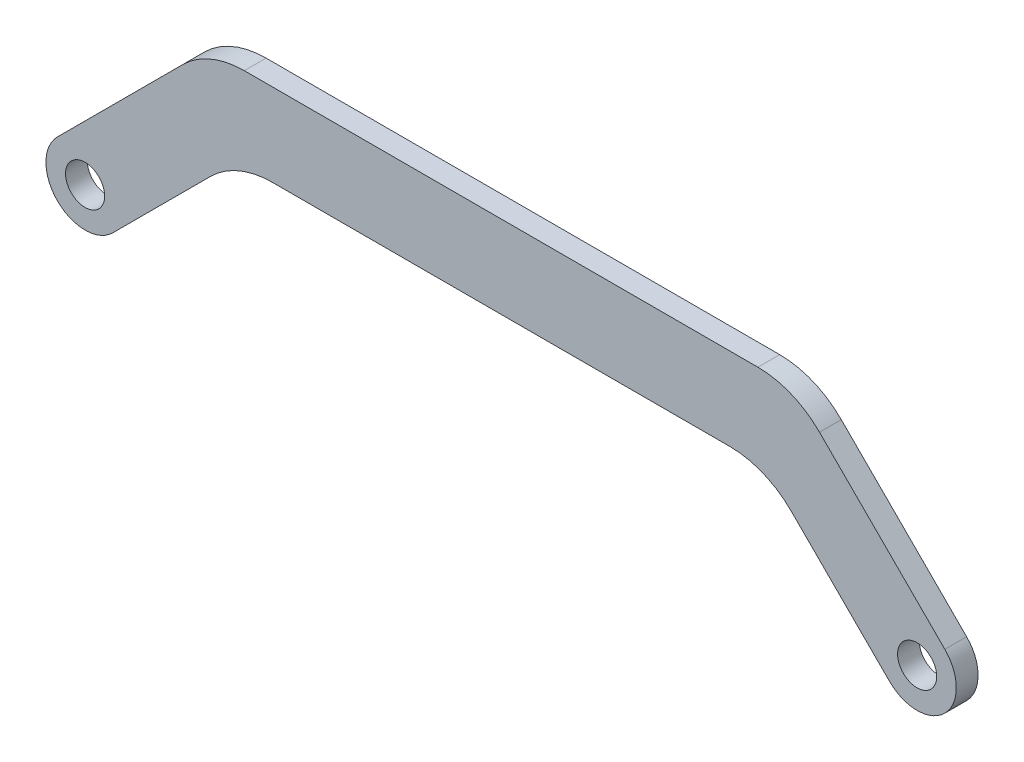
from build123d import *

# Parameters (mm, degrees)
SKETCH1_R           = 4.49
BOSS_EXTRUDE1_DEPTH = 5
FILLET1_R           = 20
FILLET2_R           = 20
FILLET3_R           = 20
FILLET4_R           = 20


with BuildPart() as part:
    # Sketch1 → Boss-Extrude1 (new body)
    with BuildSketch(Plane.XY):
        with BuildLine():
            Line((-6.356889963, 6.356889963), (28.266220074, 40.98))
            Line((28.266220074, 40.98), (162.733779926, 40.98))
            Line((162.733779926, 40.98), (197.356889963, 6.356889963))
            ThreePointArc((197.356889963, 6.356889963), (197.356889963, -6.356889963), (184.643110037, -6.356889963))
            Line((184.643110037, -6.356889963), (156.286220074, 22))
            Line((156.286220074, 22), (34.713779926, 22))
            Line((34.713779926, 22), (6.356889963, -6.356889963))
            ThreePointArc((6.356889963, -6.356889963), (-6.356889963, -6.356889963), (-6.356889963, 6.356889963))
        make_face()
        Circle(SKETCH1_R, mode=Mode.SUBTRACT)
        with Locations((191, 0)):
            Circle(SKETCH1_R, mode=Mode.SUBTRACT)
    extrude(amount=BOSS_EXTRUDE1_DEPTH)

    # Fillet1
    fillet1_edges = [part.edges().sort_by_distance(p)[0] for p in [
        (28.266220074, 40.98, 2.5),
    ]]
    fillet(fillet1_edges, radius=FILLET1_R)

    # Fillet2
    fillet2_edges = [part.edges().sort_by_distance(p)[0] for p in [
        (34.713779926, 22, 2.5),
    ]]
    fillet(fillet2_edges, radius=FILLET2_R)

    # Fillet3
    fillet3_edges = [part.edges().sort_by_distance(p)[0] for p in [
        (162.733779926, 40.98, 2.5),
    ]]
    fillet(fillet3_edges, radius=FILLET3_R)

    # Fillet4
    fillet4_edges = [part.edges().sort_by_distance(p)[0] for p in [
        (156.286220074, 22, 2.5),
    ]]
    fillet(fillet4_edges, radius=FILLET4_R)


solid = part.part
